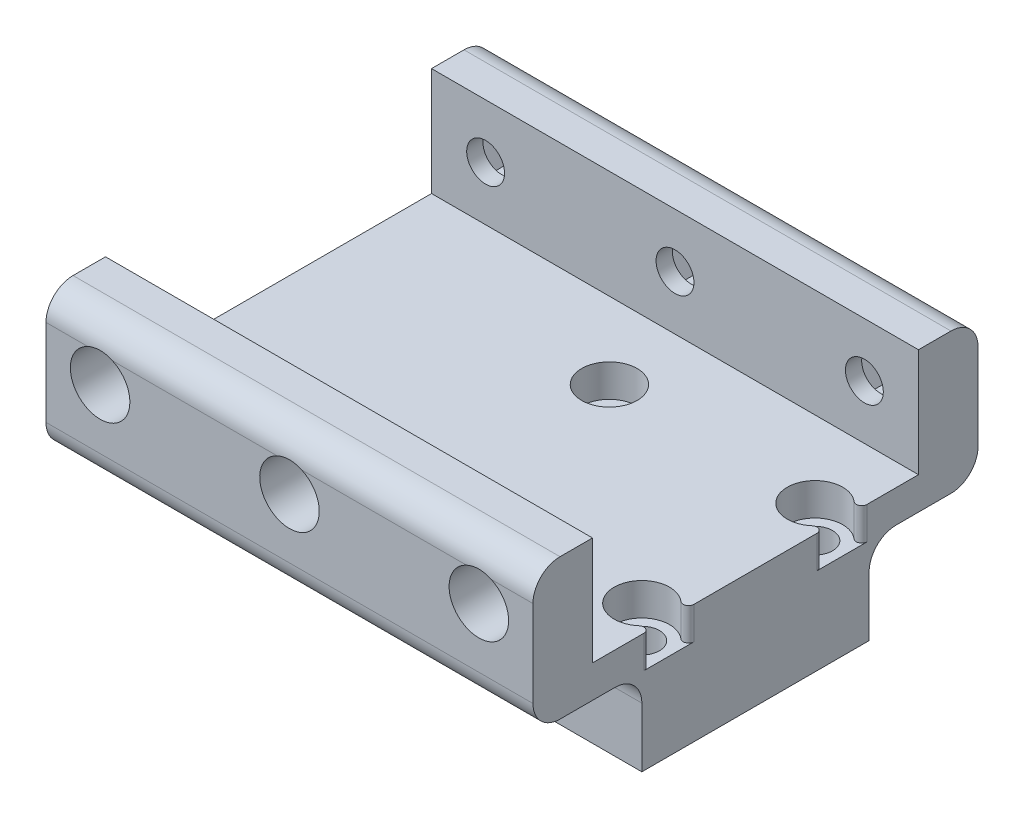
from build123d import *

# Parameters (mm, degrees)
SKETCH1_W               = 24
SKETCH1_H               = 21
SKETCH1_R               = 1.625
BOSS_EXTRUDE1_DEPTH     = 8
BOSS_EXTRUDE4_DEPTH     = 45
CUT_EXTRUDE9_DEPTH      = 57.756194596
CUT_EXTRUDE9_DEPTH_BACK = 57.756194596
SKETCH15_R              = 1.75
FILLET3_R               = 2.5
SKETCH4_R               = 2.5625
CUT_EXTRUDE3_DEPTH      = 3
FILLET7_R               = 0.5
SKETCH20_R              = 2.75
CUT_EXTRUDE15_DEPTH     = 4
CUT_EXTRUDE16_DEPTH     = 4


with BuildPart() as part:
    # Sketch1 → Boss-Extrude1 (new body)
    with BuildSketch(Plane(origin=(0, 0, 0), x_dir=(1, 0, 0), z_dir=(0, 1, 0))):
        Rectangle(SKETCH1_W, SKETCH1_H)
        with Locations((-9.5, 8)):
            Circle(SKETCH1_R, mode=Mode.SUBTRACT)
        with Locations((9.5, 8)):
            Circle(SKETCH1_R, mode=Mode.SUBTRACT)
        with Locations((9.5, -8)):
            Circle(SKETCH1_R, mode=Mode.SUBTRACT)
        with Locations((-9.5, -8)):
            Circle(SKETCH1_R, mode=Mode.SUBTRACT)
    extrude(amount=BOSS_EXTRUDE1_DEPTH)

    # Sketch7 → Boss-Extrude4 (add)
    with BuildSketch(Plane(origin=(12, 0, 0), x_dir=(0, 0, -1), z_dir=(1, 0, 0))):
        Polygon((-20.5625, 21), (-20.5625, 8), (20.5625, 8), (20.5625, 21), (15.0625, 21), (15.0625, 11), (-15.0625, 11), (-15.0625, 21), align=None)
    extrude(amount=-BOSS_EXTRUDE4_DEPTH)

    # Sketch15 → Cut-Extrude9 (cut, two sides: drawn at the far end of the back side and taken through both)
    with BuildSketch(Plane.XY.offset(20.5625).offset(-CUT_EXTRUDE9_DEPTH_BACK)):
        with Locations((7, 16)):
            Circle(SKETCH15_R)
        with Locations((-10.5, 16)):
            Circle(SKETCH15_R)
        with Locations((-28, 16)):
            Circle(SKETCH15_R)
    extrude(amount=CUT_EXTRUDE9_DEPTH + CUT_EXTRUDE9_DEPTH_BACK, mode=Mode.SUBTRACT)

    # Fillet3
    fillet3_edges = [part.edges().sort_by_distance(p)[0] for p in [
        (0, 8, -10.5),
        (-12, 8, 0),
        (0, 8, 10.5),
        (-10.5, 8, -20.5625),
        (-10.5, 8, 20.5625),
        (-10.5, 21, 20.5625),
        (-10.5, 21, -20.5625),
    ]]
    fillet(fillet3_edges, radius=FILLET3_R)

    # Sketch4 → Cut-Extrude3 (cut)
    with BuildSketch(Plane(origin=(0, 11, 0), x_dir=(1, 0, 0), z_dir=(0, 1, 0))):
        with Locations((-9.5, 8)):
            Circle(SKETCH4_R)
        with Locations((9.5, 8)):
            Circle(SKETCH4_R)
        with Locations((9.5, -8)):
            Circle(SKETCH4_R)
        with Locations((-9.5, -8)):
            Circle(SKETCH4_R)
    extrude(amount=-CUT_EXTRUDE3_DEPTH, mode=Mode.SUBTRACT)

    # Fillet7
    fillet7_edges = [part.edges().sort_by_distance(p)[0] for p in [
        (12, 9.5, -8.5625),
        (12, 9.5, -7.4375),
        (12, 9.5, 7.4375),
        (12, 9.5, 8.5625),
    ]]
    fillet(fillet7_edges, radius=FILLET7_R)

    # Sketch20 → Cut-Extrude15 (cut)
    with BuildSketch(Plane.XY.offset(20.5625)):
        with Locations((-28, 16)):
            Circle(SKETCH20_R)
        with Locations((-10.5, 16)):
            Circle(SKETCH20_R)
        with Locations((7, 16)):
            Circle(SKETCH20_R)
    extrude(amount=-CUT_EXTRUDE15_DEPTH, mode=Mode.SUBTRACT)

    # Sketch21 → Cut-Extrude16 (cut)
    with BuildSketch(Plane(origin=(0, 0, -20.5625), x_dir=(-1, 0, 0), z_dir=(0, 0, -1))):
        Polygon((-5.441154273, 13.3), (-3.882308546, 16), (-5.441154273, 18.7), (-8.558845727, 18.7), (-10.117691454, 16), (-8.558845727, 13.3), align=None)
        Polygon((12.058845727, 13.3), (13.617691454, 16), (12.058845727, 18.7), (8.941154273, 18.7), (7.382308546, 16), (8.941154273, 13.3), align=None)
        Polygon((29.558845727, 13.3), (31.117691454, 16), (29.558845727, 18.7), (26.441154273, 18.7), (24.882308546, 16), (26.441154273, 13.3), align=None)
    extrude(amount=-CUT_EXTRUDE16_DEPTH, mode=Mode.SUBTRACT)


solid = part.part
